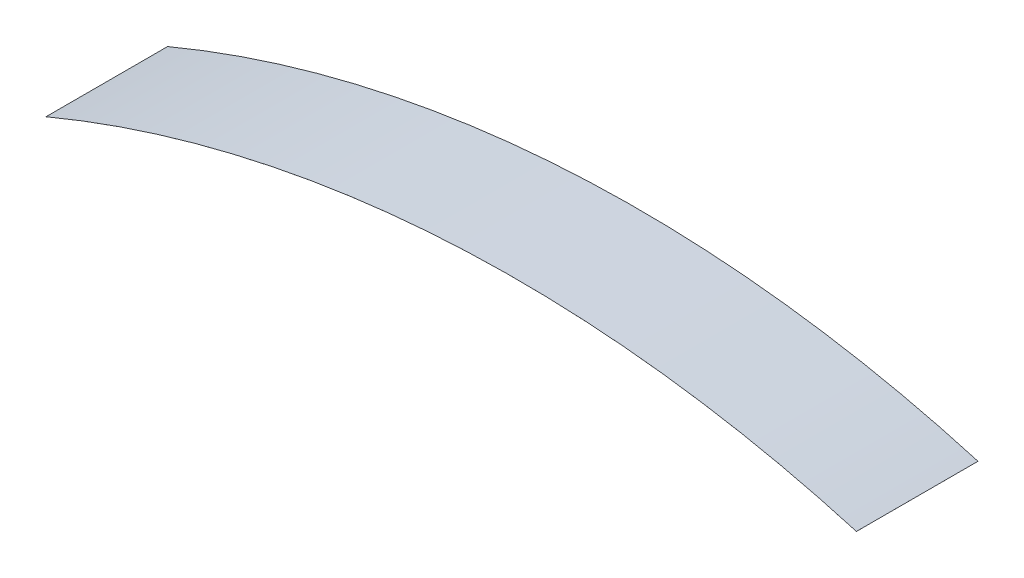
from build123d import *

# Parameters (mm, degrees)
EXTRUDE_THIN1_DEPTH = 15


with BuildPart() as part:
    # Sketch1 → Extrude-Thin1 (new body)
    with BuildSketch(Plane.XY):
        with BuildLine():
            ThreePointArc((41.976786482, 144.006768579), (-8.511621644, 149.758312948), (-58.023213518, 138.323196511))
            Line((-58.023213518, 138.323196511), (-58.023600339, 138.324118666))
            ThreePointArc((-58.023600339, 138.324118666), (-8.511678388, 149.759311337), (41.977066327, 144.007728624))
            Line((41.977066327, 144.007728624), (41.976786482, 144.006768579))
        make_face()
    extrude(amount=EXTRUDE_THIN1_DEPTH)


solid = part.part
